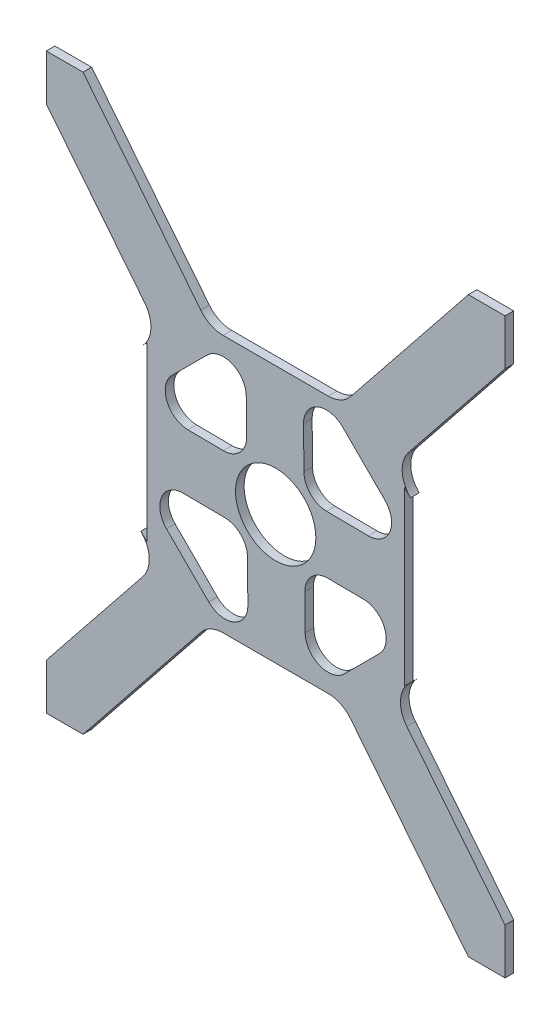
from build123d import *

# Parameters (mm, degrees)
SKETCH1_R           = 14
BOSS_EXTRUDE1_DEPTH = 3
SKETCH2_OUTSIDE_W   = 194.236
SKETCH2_OUTSIDE_H   = 194.236
SKETCH2_OUTSIDE_W_2 = 89.848932168
SKETCH2_OUTSIDE_H_2 = 89.848932168
CUT_EXTRUDE1_DEPTH  = 3
BOSS_EXTRUDE2_DEPTH = 3


with BuildPart() as part:
    # Sketch1 → Boss-Extrude1 (new body)
    with BuildSketch(Plane.XY):
        Polygon((0.667250758, 74.924466084), (-74.924466084, -0.667250758), (-0.667250758, -74.924466084), (74.924466084, 0.667250758), align=None)
        Circle(SKETCH1_R, mode=Mode.SUBTRACT)
        with BuildLine():
            Line((36.187095947, -23.927983755), (23.927983755, -36.187095947))
            ThreePointArc((23.927983755, -36.187095947), (15.242424375, -37.934763642), (10.271443313, -30.601099389))
            Line((10.271443313, -30.601099389), (10.161887104, -18.232430989))
            ThreePointArc((10.161887104, -18.232430989), (12.504719048, -12.504719048), (18.232430989, -10.161887104))
            Line((18.232430989, -10.161887104), (30.601099389, -10.271443313))
            ThreePointArc((30.601099389, -10.271443313), (37.934763642, -15.242424375), (36.187095947, -23.927983755))
        make_face(mode=Mode.SUBTRACT)
        with BuildLine():
            Line((-23.927983755, 36.187095947), (-36.187095947, 23.927983755))
            ThreePointArc((-36.187095947, 23.927983755), (-37.934763642, 15.242424375), (-30.601099389, 10.271443313))
            Line((-30.601099389, 10.271443313), (-18.232430989, 10.161887104))
            ThreePointArc((-18.232430989, 10.161887104), (-12.504719048, 12.504719048), (-10.161887104, 18.232430989))
            Line((-10.161887104, 18.232430989), (-10.271443313, 30.601099389))
            ThreePointArc((-10.271443313, 30.601099389), (-15.242424375, 37.934763642), (-23.927983755, 36.187095947))
        make_face(mode=Mode.SUBTRACT)
        with BuildLine():
            Line((-38.079203745, -23.370377474), (-23.370377474, -38.079203745))
            ThreePointArc((-23.370377474, -38.079203745), (-14.619353482, -39.79975511), (-9.713837032, -32.351491804))
            Line((-9.713837032, -32.351491804), (-9.842977457, -17.771805959))
            ThreePointArc((-9.842977457, -17.771805959), (-12.185809401, -12.185809401), (-17.771805959, -9.842977457))
            Line((-17.771805959, -9.842977457), (-32.351491804, -9.713837032))
            ThreePointArc((-32.351491804, -9.713837032), (-39.79975511, -14.619353482), (-38.079203745, -23.370377474))
        make_face(mode=Mode.SUBTRACT)
        with BuildLine():
            Line((9.713837032, 32.351491804), (9.842977457, 17.771805959))
            ThreePointArc((9.842977457, 17.771805959), (12.185809401, 12.185809401), (17.771805959, 9.842977457))
            Line((17.771805959, 9.842977457), (32.351491804, 9.713837032))
            ThreePointArc((32.351491804, 9.713837032), (39.79975511, 14.619353482), (38.079203745, 23.370377474))
            Line((38.079203745, 23.370377474), (23.370377474, 38.079203745))
            ThreePointArc((23.370377474, 38.079203745), (14.619353482, 39.79975511), (9.713837032, 32.351491804))
        make_face(mode=Mode.SUBTRACT)
    extrude(amount=BOSS_EXTRUDE1_DEPTH)

    # Sketch2 outside → Cut-Extrude1 (cut)
    with BuildSketch(Plane.XY.offset(3)):
        Rectangle(SKETCH2_OUTSIDE_W, SKETCH2_OUTSIDE_H)
        Rectangle(SKETCH2_OUTSIDE_W_2, SKETCH2_OUTSIDE_H_2, mode=Mode.SUBTRACT)
    extrude(amount=-CUT_EXTRUDE1_DEPTH, mode=Mode.SUBTRACT)

    # Sketch3 → Boss-Extrude2 (add)
    with BuildSketch(Plane.XY.offset(3)):
        with BuildLine():
            Line((-80, -100), (-67.193751525, -100))
            Line((-67.193751525, -100), (-26.135764012, -48.677515609))
            ThreePointArc((-26.135764012, -48.677515609), (-22.658963222, -45.911433721), (-18.327075918, -44.924466084))
            Line((-18.327075918, -44.924466084), (-30.667250758, -44.924466084))
            Line((-30.667250758, -44.924466084), (-47.039809367, -28.551907475))
            ThreePointArc((-47.039809367, -28.551907475), (-44.126179551, -35.06997143), (-46.302189085, -41.869925762))
            Line((-46.302189085, -41.869925762), (-80, -83.992189406))
            Line((-80, -83.992189406), (-80, -100))
        make_face()
        with BuildLine():
            Line((29.332749242, -44.924466084), (18.327075918, -44.924466084))
            ThreePointArc((18.327075918, -44.924466084), (22.658963222, -45.911433721), (26.135764012, -48.677515609))
            Line((26.135764012, -48.677515609), (67.193751525, -100))
            Line((67.193751525, -100), (80, -100))
            Line((80, -100), (80, -83.992189406))
            Line((80, -83.992189406), (45.7090773, -41.128536031))
            ThreePointArc((45.7090773, -41.128536031), (43.533067766, -34.328581698), (46.446697582, -27.810517744))
            Line((46.446697582, -27.810517744), (29.332749242, -44.924466084))
        make_face()
        with BuildLine():
            Line((-46.446697582, 27.810517744), (-29.332749242, 44.924466084))
            Line((-29.332749242, 44.924466084), (-18.327075918, 44.924466084))
            ThreePointArc((-18.327075918, 44.924466084), (-22.658963222, 45.911433721), (-26.135764012, 48.677515609))
            Line((-26.135764012, 48.677515609), (-67.193751525, 100))
            Line((-67.193751525, 100), (-80, 100))
            Line((-80, 100), (-80, 83.992189406))
            Line((-80, 83.992189406), (-45.7090773, 41.128536031))
            ThreePointArc((-45.7090773, 41.128536031), (-43.533067766, 34.328581698), (-46.446697582, 27.810517744))
        make_face()
        with BuildLine():
            Line((30.667250758, 44.924466084), (47.039809367, 28.551907475))
            ThreePointArc((47.039809367, 28.551907475), (44.126179551, 35.06997143), (46.302189085, 41.869925762))
            Line((46.302189085, 41.869925762), (80, 83.992189406))
            Line((80, 83.992189406), (80, 100))
            Line((80, 100), (67.193751525, 100))
            Line((67.193751525, 100), (26.135764012, 48.677515609))
            ThreePointArc((26.135764012, 48.677515609), (22.658963222, 45.911433721), (18.327075918, 44.924466084))
            Line((18.327075918, 44.924466084), (30.667250758, 44.924466084))
        make_face()
    extrude(amount=-BOSS_EXTRUDE2_DEPTH)


solid = part.part
